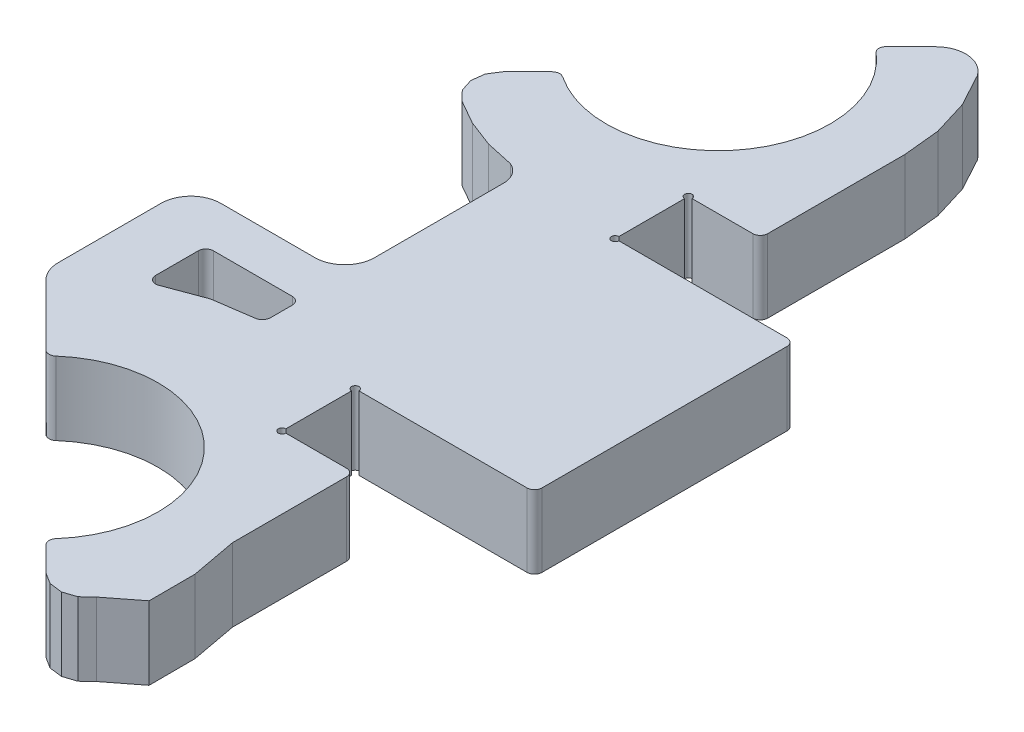
from build123d import *

# Parameters (mm, degrees)
BOSS_EXTRU_1_DEPTH = 4.900038


with BuildPart() as part:
    # Esquisse1 → Boss.-Extru.1 (new body)
    with BuildSketch(Plane.XZ):
        with BuildLine():
            Line((-0.815337621, 41.120678267), (-0.815337621, 34.249109833))
            ThreePointArc((-0.815337621, 34.249109833), (-0.229551316, 32.834896593), (1.184661924, 32.249110289))
            Line((1.184661924, 32.249110289), (7.484661488, 32.249110289))
            ThreePointArc((7.484661488, 32.249110289), (8.898874021, 31.663324278), (9.484660032, 30.249111745))
            Line((9.484660032, 30.249111745), (9.484660032, 21.610522714))
            ThreePointArc((9.484660032, 21.610522714), (9.236435528, 20.794530717), (8.575860046, 20.254995384))
            Line((8.575860046, 20.254995384), (6.723618468, 19.851925476))
            Line((6.723618468, 19.851925476), (4.953621871, 19.173415631))
            Line((4.953621871, 19.173415631), (3.306576246, 18.235075845))
            Line((3.306576246, 18.235075845), (2.706450383, 17.599525989))
            Line((2.706450383, 17.599525989), (2.434698445, 16.768726179))
            Line((2.434698445, 16.768726179), (2.54322942, 15.901386376))
            Line((2.54322942, 15.901386376), (3.011310314, 15.163166545))
            Line((3.011310314, 15.163166545), (4.654204939, 13.520266919))
            Line((4.654204939, 13.520266919), (4.868308891, 13.393666948))
            Line((4.868308891, 13.393666948), (5.116923834, 13.38588695))
            Line((5.116923834, 13.38588695), (5.338521783, 13.498866924))
            ThreePointArc((5.338521783, 13.498866924), (15.463306351, 11.777438967), (14.377512906, 1.564915804))
            ThreePointArc((14.377512906, 1.564915804), (14.224756538, 1.21764125), (14.398922901, 0.88059496))
            Line((14.398922901, 0.88059496), (16.041812526, -0.762298665))
            ThreePointArc((16.041812526, -0.762298665), (17.647380358, -1.33891093), (19.113721826, -0.467032233))
            Line((19.113721826, -0.467032233), (20.286561559, 1.706666772))
            Line((20.286561559, 1.706666772), (21.009101394, 4.068549234))
            Line((21.009101394, 4.068549234), (21.253121339, 6.526390674))
            Line((21.253121339, 6.526390674), (21.253121339, 15.699105144))
            ThreePointArc((21.253121339, 15.699105144), (21.106674763, 16.052658454), (20.753121453, 16.19910503))
            Line((20.753121453, 16.19910503), (16.687787672, 16.19910503))
            ThreePointArc((16.687787672, 16.19910503), (16.261005783, 16.022326184), (16.43778463, 16.449108073))
            Line((16.43778463, 16.449108073), (16.43778463, 20.849107628))
            ThreePointArc((16.43778463, 20.849107628), (16.261009771, 21.275879889), (16.687782032, 21.09910503))
            Line((16.687782032, 21.09910503), (27.937782009, 21.09910503))
            ThreePointArc((27.937782009, 21.09910503), (28.291335319, 21.245551606), (28.437781895, 21.599104916))
            Line((28.437781895, 21.599104916), (28.437781895, 37.999105144))
            ThreePointArc((28.437781895, 37.999105144), (28.291335319, 38.352658454), (27.937782009, 38.49910503))
            Line((27.937782009, 38.49910503), (16.687785131, 38.49910503))
            ThreePointArc((16.687785131, 38.49910503), (16.26100758, 38.322327981), (16.43778463, 38.749105532))
            Line((16.43778463, 38.749105532), (16.43778463, 43.14910503))
            ThreePointArc((16.43778463, 43.14910503), (16.261007934, 43.575881726), (16.68778463, 43.39910503))
            Line((16.68778463, 43.39910503), (20.753121453, 43.39910503))
            ThreePointArc((20.753121453, 43.39910503), (21.106674763, 43.545551606), (21.253121339, 43.899104916))
            Line((21.253121339, 43.899104916), (21.253121339, 51.526382419))
            Line((21.253121339, 51.526382419), (21.824434721, 54.609591947))
            Line((21.824434721, 54.609591947), (21.833435025, 57.694186853))
            Line((21.833435025, 57.694186853), (19.84525724, 59.242523707))
            Line((19.84525724, 59.242523707), (19.209707385, 59.84265357))
            Line((19.209707385, 59.84265357), (18.378917574, 60.114403508))
            Line((18.378917574, 60.114403508), (17.511567772, 60.005873533))
            Line((17.511567772, 60.005873533), (16.77334794, 59.537793639))
            Line((16.77334794, 59.537793639), (15.130452537, 57.894888236))
            ThreePointArc((15.130452537, 57.894888236), (14.984254305, 57.556974361), (15.109048319, 57.21058417))
            ThreePointArc((15.109048319, 57.21058417), (14.787965349, 46.945806953), (4.52318847, 46.624713214))
            ThreePointArc((4.52318847, 46.624713214), (4.176789338, 46.749509832), (3.838867319, 46.603307018))
            Line((3.838867319, 46.603307018), (-0.229554407, 42.534884292))
            ThreePointArc((-0.229554407, 42.534884292), (-0.663097525, 41.886041033), (-0.815337621, 41.120678267))
        make_face()
        with BuildLine():
            Line((9.484660032, 37.259480615), (9.484660032, 35.749109175))
            ThreePointArc((9.484660032, 35.749109175), (9.338213749, 35.395556572), (8.984661146, 35.249110289))
            Line((8.984661146, 35.249110289), (3.684660032, 35.249110289))
            ThreePointArc((3.684660032, 35.249110289), (3.331106642, 35.395556899), (3.184660032, 35.749110289))
            Line((3.184660032, 35.749110289), (3.184660032, 38.615420306))
            ThreePointArc((3.184660032, 38.615420306), (3.421541448, 39.040593437), (3.907737867, 39.062910204))
            Line((3.907737867, 39.062910204), (6.386454303, 38.139900415))
            Line((6.386454303, 38.139900415), (9.003891164, 37.759110289))
            ThreePointArc((9.003891164, 37.759110289), (9.329866443, 37.591655279), (9.484660032, 37.259480615))
        make_face(mode=Mode.SUBTRACT)
    extrude(amount=-BOSS_EXTRU_1_DEPTH)


solid = part.part
